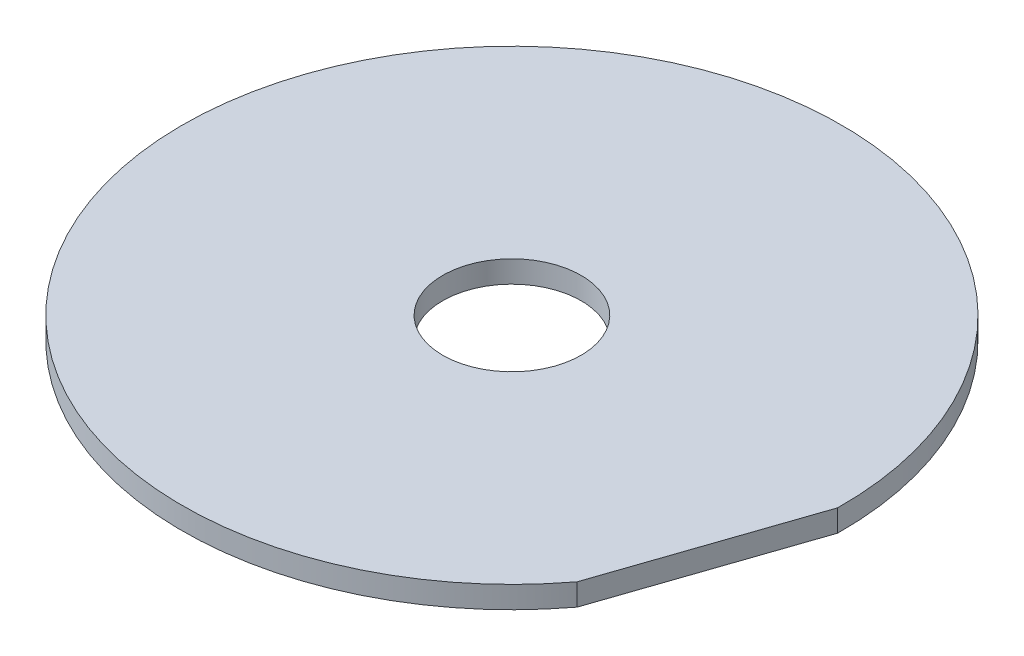
from build123d import *

# Parameters (mm, degrees)
SKIZZE1_R                       = 15
SKIZZE1_R_2                     = 3.15
AUFSATZ_LINEAR_AUSTRAGEN1_DEPTH = 1
SCHNITT_LINEAR_AUSTRAGEN1_DEPTH = 1


with BuildPart() as part:
    # Skizze1 → Aufsatz-Linear austragen1 (new body)
    with BuildSketch(Plane(origin=(0, 0, 0), x_dir=(1, 0, 0), z_dir=(0, 1, 0))):
        with Locations(Location((0, 0, 0), (0, 0, 270))):
            Circle(SKIZZE1_R)
        with Locations(Location((0, 0, 0), (0, 0, 270))):
            Circle(SKIZZE1_R_2, mode=Mode.SUBTRACT)
    extrude(amount=AUFSATZ_LINEAR_AUSTRAGEN1_DEPTH)

    # Skizze2 → Schnitt-Linear austragen1 (cut)
    with BuildSketch(Plane(origin=(0, 1, 0), x_dir=(1, 0, 0), z_dir=(0, 1, 0))):
        Polygon((11.988607619, -9.015169846), (14.998976734, -0.175205365), (16.976738313, -0.848713996), (13.966369198, -9.688678477), align=None)
    extrude(amount=-SCHNITT_LINEAR_AUSTRAGEN1_DEPTH, mode=Mode.SUBTRACT)


solid = part.part
